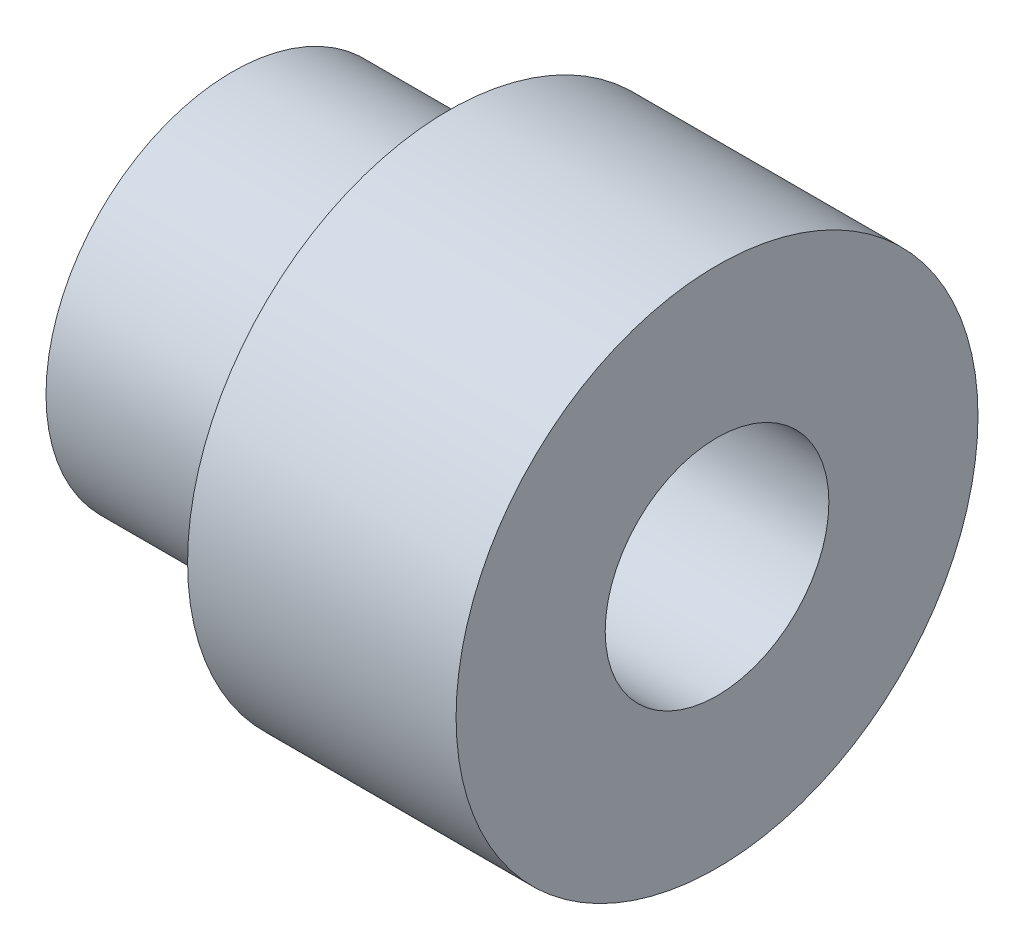
from build123d import *

# Parameters (mm, degrees)
SKETCH3_R          = 3
CUT_EXTRUDE1_DEPTH = 17.340134638


with BuildPart() as part:
    # Sketch1 → Revolve1 (revolve)
    with BuildSketch(Plane.XY, mode=Mode.PRIVATE) as revolve1_sk:
        Polygon((0, 0), (0, 5), (5.797701149, 5), (5.797701149, 7), (13, 7), (13, 0), align=None)
    revolve(revolve1_sk.sketch.rotate(Axis((0, 0, 0), (1, 0, 0)), 90), axis=Axis((0, 0, 0), (1, 0, 0)))

    # Sketch3 → Cut-Extrude1 (cut, through all)
    with BuildSketch(Plane(origin=(0, 0, 0), x_dir=(0, 0, -1), z_dir=(1, 0, 0))):
        with Locations(Location((0, 0, 0), (0, 0, 180))):
            Circle(SKETCH3_R)
    extrude(amount=CUT_EXTRUDE1_DEPTH, mode=Mode.SUBTRACT)


solid = part.part
